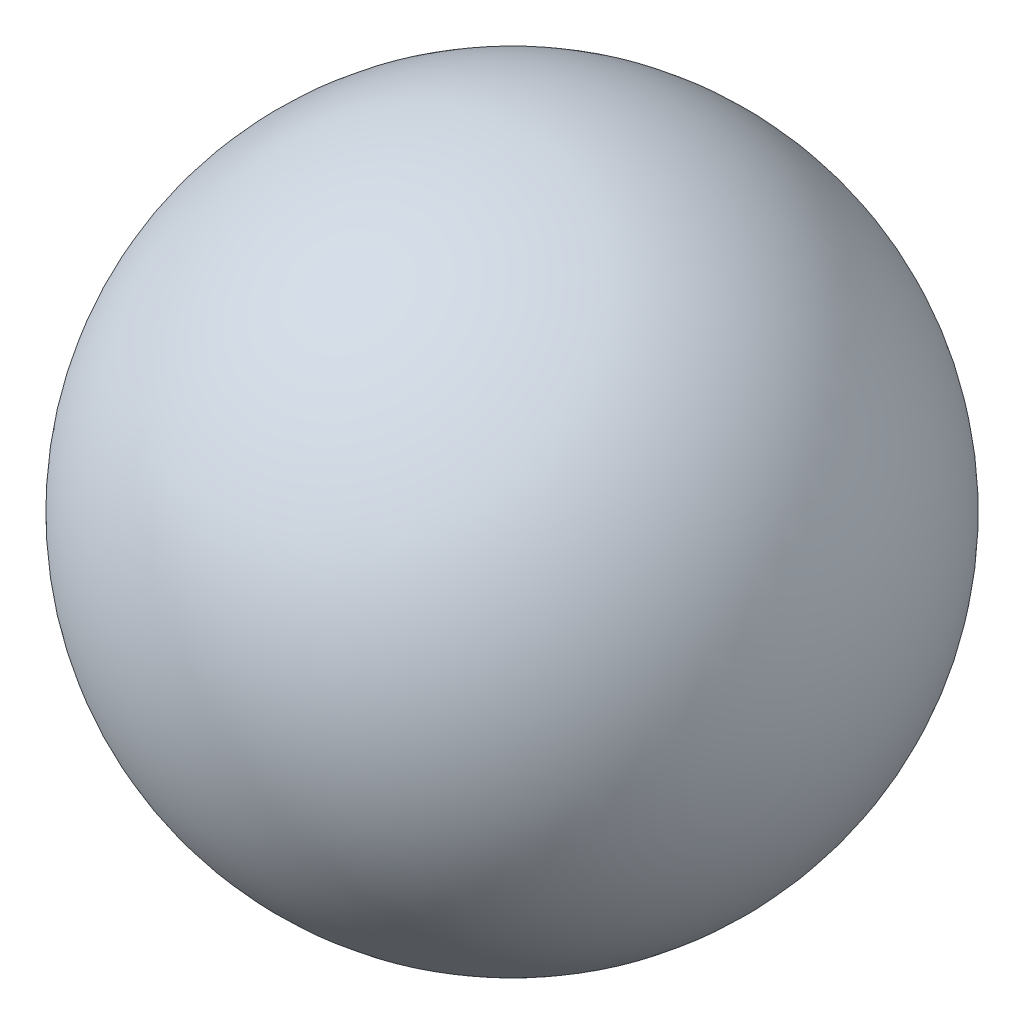
from build123d import *


with BuildPart() as part:
    # 草图1 → 旋转1 (revolve)
    with BuildSketch(Plane.XY):
        with BuildLine():
            Line((0, 105), (0, -105))
            ThreePointArc((0, -105), (105, 0), (0, 105))
        make_face()
    revolve(axis=Axis((0, 105, 0), (0, -1, 0)))


solid = part.part
